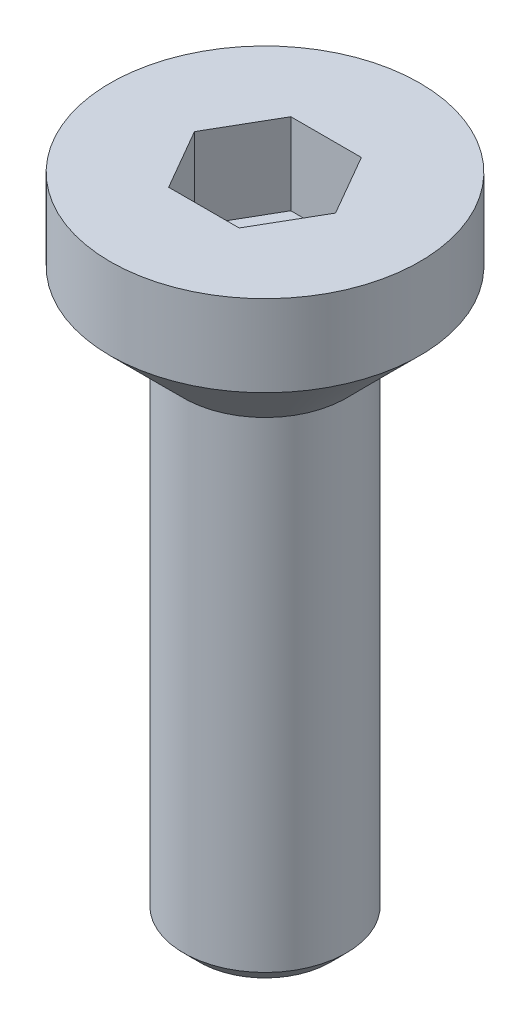
from build123d import *

# Parameters (mm, degrees)
CUT_EXTRUDE_1_DEPTH = 1


with BuildPart() as part:
    # 草图1 → 旋转1 (revolve)
    with BuildSketch(Plane.XY, mode=Mode.PRIVATE) as revolve_1_sk:
        Polygon((0, 3.329659811), (-1.9, 3.329659811), (-1.9, 2.329659811), (-1, 1.429659811), (-1, -4.470340189), (-0.8, -4.670340189), (0, -4.670340189), align=None)
    revolve(revolve_1_sk.sketch.rotate(Axis((0, -3.769198969, 0), (0, 1, 0)), 270), axis=Axis((0, -3.769198969, 0), (0, 1, 0)))

    # 草图2 → 切除-拉伸1 (cut)
    with BuildSketch(Plane(origin=(0, 3.329659811, 0), x_dir=(1, 0, 0), z_dir=(0, 1, 0))):
        Polygon((-0.433012702, -0.75), (0.433012702, -0.75), (0.866025404, 0), (0.433012702, 0.75), (-0.433012702, 0.75), (-0.866025404, 0), align=None)
    extrude(amount=-CUT_EXTRUDE_1_DEPTH, mode=Mode.SUBTRACT)


solid = part.part
